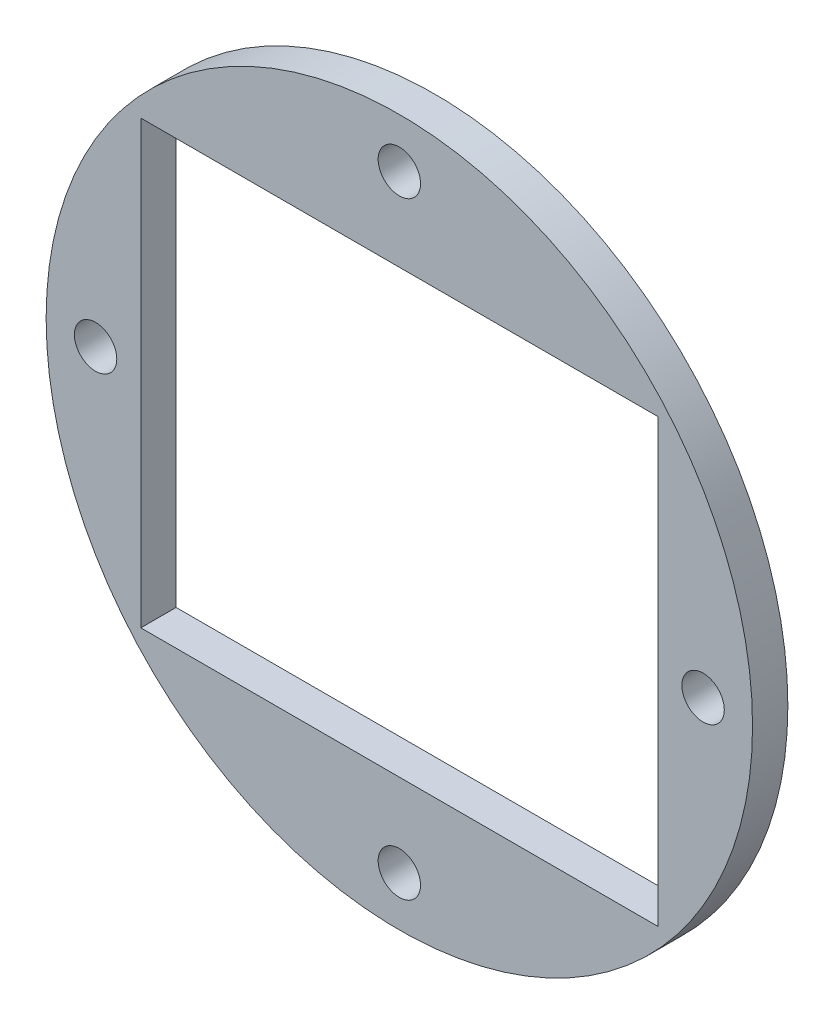
from build123d import *

# Parameters (mm, degrees)
ESQUISSE1_R        = 50
ESQUISSE1_R_2      = 3
ESQUISSE1_W        = 73.2
ESQUISSE1_H        = 62.5
BOSS_EXTRU_1_DEPTH = 5


with BuildPart() as part:
    # Esquisse1 → Boss.-Extru.1 (new body)
    with BuildSketch(Plane.XY):
        Circle(ESQUISSE1_R)
        with Locations((43, 0)):
            Circle(ESQUISSE1_R_2, mode=Mode.SUBTRACT)
        with Locations((0, 43)):
            Circle(ESQUISSE1_R_2, mode=Mode.SUBTRACT)
        with Locations((-43, 0)):
            Circle(ESQUISSE1_R_2, mode=Mode.SUBTRACT)
        with Locations((0, -43)):
            Circle(ESQUISSE1_R_2, mode=Mode.SUBTRACT)
        Rectangle(ESQUISSE1_W, ESQUISSE1_H, mode=Mode.SUBTRACT)
    extrude(amount=BOSS_EXTRU_1_DEPTH)


solid = part.part
